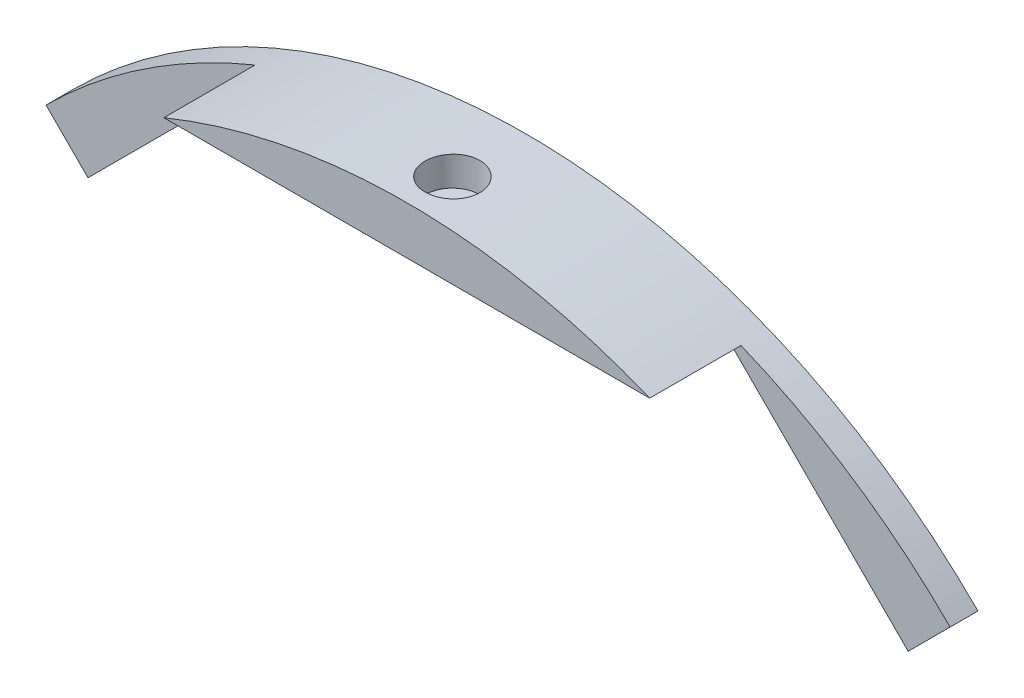
from build123d import *

# Parameters (mm, degrees)
BOSS_EXTRUDE4_DEPTH = 6.1
BOSS_EXTRUDE5_START = 20
BOSS_EXTRUDE5_DEPTH = 20
SKETCH7_R           = 2.75
CUT_EXTRUDE1_DEPTH  = 109.516757445
SKETCH8_R           = 6
CUT_EXTRUDE2_DEPTH  = 20


with BuildPart() as part:
    # Sketch5 → Boss-Extrude4 (new body)
    with BuildSketch(Plane.XY):
        with BuildLine():
            Line((-89.802561211, 89.802561211), (-50.105122421, 129.5))
            Line((-50.105122421, 129.5), (50.105122421, 129.5))
            Line((50.105122421, 129.5), (89.802561211, 89.802561211))
            Line((89.802561211, 89.802561211), (98.994949366, 98.994949366))
            ThreePointArc((98.994949366, 98.994949366), (0, 140), (-98.994949366, 98.994949366))
            Line((-98.994949366, 98.994949366), (-89.802561211, 89.802561211))
        make_face()
    extrude(amount=-BOSS_EXTRUDE4_DEPTH)

    # Sketch6 → Boss-Extrude5 (add)
    with BuildSketch(Plane.XY.offset(BOSS_EXTRUDE5_START)):
        with BuildLine():
            Line((0, 129.5), (-53.195394538, 129.5))
            ThreePointArc((-53.195394538, 129.5), (0, 140), (53.195394538, 129.5))
            Line((53.195394538, 129.5), (0, 129.5))
        make_face()
    extrude(amount=-BOSS_EXTRUDE5_DEPTH)

    # Sketch7 → Cut-Extrude1 (cut, through all)
    with BuildSketch(Plane.XZ.offset(-129.5)):
        with Locations(Location((0, 10, 0), (0, 0, 270))):
            Circle(SKETCH7_R)
    extrude(amount=-CUT_EXTRUDE1_DEPTH, mode=Mode.SUBTRACT)

    # Sketch8 → Cut-Extrude2 (cut)
    with BuildSketch(Plane(origin=(0, 133.5, 0), x_dir=(-1, 0, 0), z_dir=(0, -1, 0))):
        with Locations(Location((0, -10, 0), (0, 0, 90))):
            Circle(SKETCH8_R)
    extrude(amount=-CUT_EXTRUDE2_DEPTH, mode=Mode.SUBTRACT)


solid = part.part
